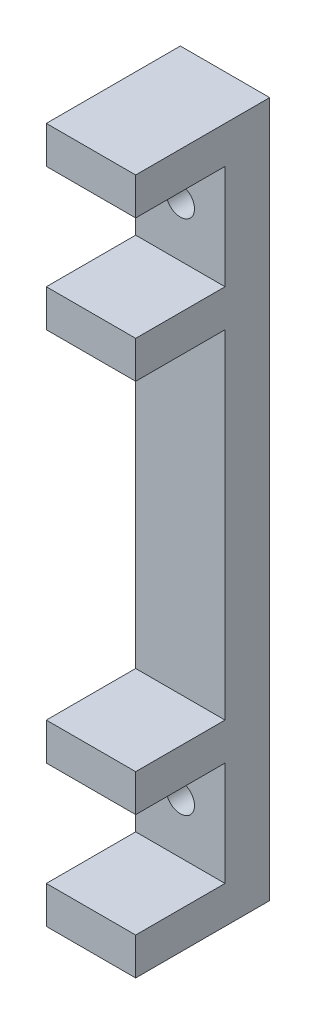
from build123d import *

# Parameters (mm, degrees)
ESQUISSE1_W                    = 6
ESQUISSE1_H                    = 42.7
ESQUISSE1_R                    = 0.95
BOSS_EXTRU_1_DEPTH             = 3
ESQUISSE2_W                    = 6
ESQUISSE2_H                    = 2.5
BOSS_EXTRU_2_DEPTH             = 6
BOSS_EXTRU_2_DIRECTION_2_REACH = 40.932


with BuildPart() as part:
    # Esquisse1 → Boss.-Extru.1 (new body)
    with BuildSketch(Plane.XY):
        with Locations((0, 17.35)):
            Rectangle(ESQUISSE1_W, ESQUISSE1_H)
        Circle(ESQUISSE1_R, mode=Mode.SUBTRACT)
        with Locations((0, 34.7)):
            Circle(ESQUISSE1_R, mode=Mode.SUBTRACT)
    extrude(amount=BOSS_EXTRU_1_DEPTH)

    # Esquisse2 → Boss.-Extru.2 (add)
    with BuildSketch(Plane.XY.offset(3)):
        with Locations((0, 4.75)):
            Rectangle(ESQUISSE2_W, ESQUISSE2_H)
        with Locations((0, 39.45)):
            Rectangle(ESQUISSE2_W, ESQUISSE2_H)
        with Locations((0, 29.95)):
            Rectangle(ESQUISSE2_W, ESQUISSE2_H)
        with Locations((0, -4.75)):
            Rectangle(ESQUISSE2_W, ESQUISSE2_H)
    extrude(amount=BOSS_EXTRU_2_DEPTH)

    # Boss.-Extru.2 direction 2: up to this face of the body (flat: up to its plane)
    boss_extru_2_direction_2_end = Plane(part.part.faces().sort_by_distance((0, 17.35, 0))[0])
    # Esquisse2 → Boss.-Extru.2 direction 2 (add, up to the picked face)
    with BuildSketch(Plane.XY.offset(3), mode=Mode.PRIVATE) as boss_extru_2_direction_2_sk1:
        with Locations((0, 4.75)):
            Rectangle(ESQUISSE2_W, ESQUISSE2_H)
    boss_extru_2_direction_2_tool1 = split(extrude(boss_extru_2_direction_2_sk1.sketch, amount=-BOSS_EXTRU_2_DIRECTION_2_REACH, mode=Mode.PRIVATE), bisect_by=boss_extru_2_direction_2_end, keep=Keep.BOTH, mode=Mode.PRIVATE)
    # Esquisse2 → Boss.-Extru.2 direction 2 (add, up to the picked face)
    with BuildSketch(Plane.XY.offset(3), mode=Mode.PRIVATE) as boss_extru_2_direction_2_sk2:
        with Locations((0, 39.45)):
            Rectangle(ESQUISSE2_W, ESQUISSE2_H)
    boss_extru_2_direction_2_tool2 = split(extrude(boss_extru_2_direction_2_sk2.sketch, amount=-BOSS_EXTRU_2_DIRECTION_2_REACH, mode=Mode.PRIVATE), bisect_by=boss_extru_2_direction_2_end, keep=Keep.BOTH, mode=Mode.PRIVATE)
    # Esquisse2 → Boss.-Extru.2 direction 2 (add, up to the picked face)
    with BuildSketch(Plane.XY.offset(3), mode=Mode.PRIVATE) as boss_extru_2_direction_2_sk3:
        with Locations((0, 29.95)):
            Rectangle(ESQUISSE2_W, ESQUISSE2_H)
    boss_extru_2_direction_2_tool3 = split(extrude(boss_extru_2_direction_2_sk3.sketch, amount=-BOSS_EXTRU_2_DIRECTION_2_REACH, mode=Mode.PRIVATE), bisect_by=boss_extru_2_direction_2_end, keep=Keep.BOTH, mode=Mode.PRIVATE)
    # Esquisse2 → Boss.-Extru.2 direction 2 (add, up to the picked face)
    with BuildSketch(Plane.XY.offset(3), mode=Mode.PRIVATE) as boss_extru_2_direction_2_sk4:
        with Locations((0, -4.75)):
            Rectangle(ESQUISSE2_W, ESQUISSE2_H)
    boss_extru_2_direction_2_tool4 = split(extrude(boss_extru_2_direction_2_sk4.sketch, amount=-BOSS_EXTRU_2_DIRECTION_2_REACH, mode=Mode.PRIVATE), bisect_by=boss_extru_2_direction_2_end, keep=Keep.BOTH, mode=Mode.PRIVATE)
    add(boss_extru_2_direction_2_tool1.solids().sort_by(Axis((0, 4.75, 3), (0, 0, -1)))[0])
    add(boss_extru_2_direction_2_tool2.solids().sort_by(Axis((0, 39.45, 3), (0, 0, -1)))[0])
    add(boss_extru_2_direction_2_tool3.solids().sort_by(Axis((0, 29.95, 3), (0, 0, -1)))[0])
    add(boss_extru_2_direction_2_tool4.solids().sort_by(Axis((0, -4.75, 3), (0, 0, -1)))[0])


solid = part.part
